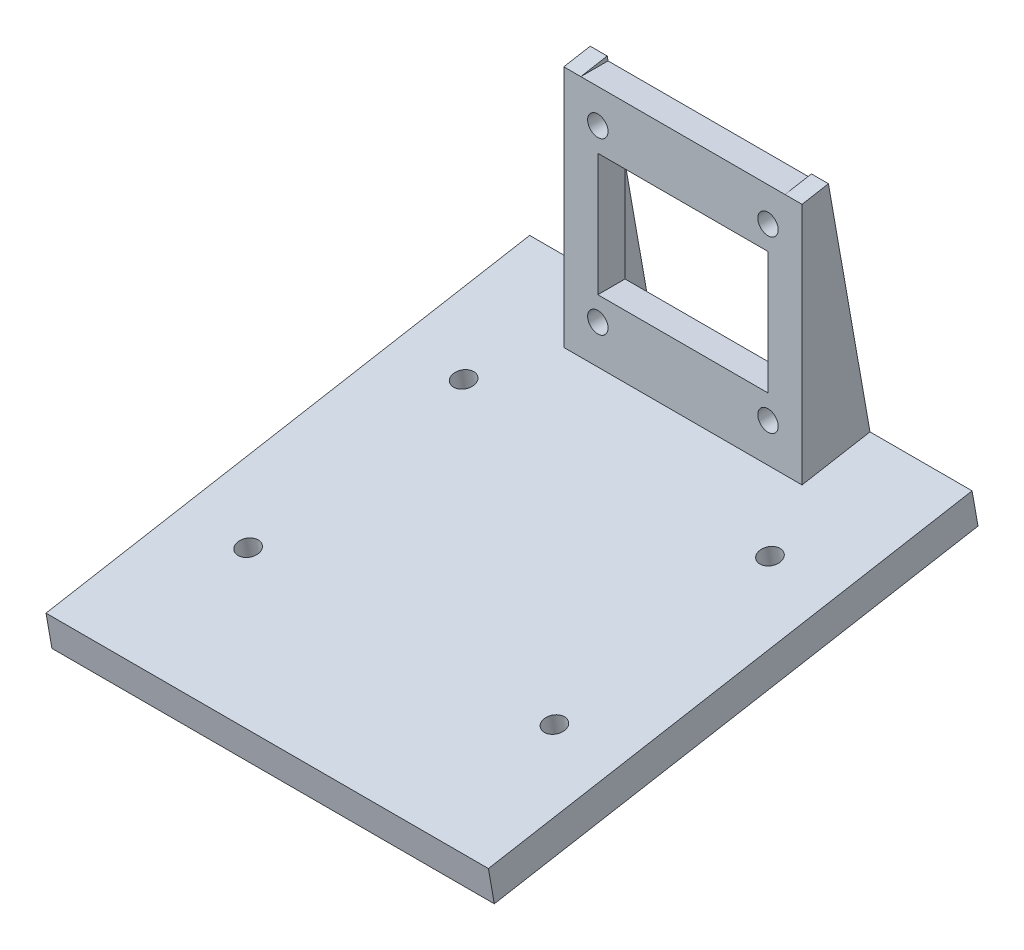
from build123d import *

# Parameters (mm, degrees)
SKETCH_1_W          = 35
SKETCH_1_H          = 35
SKETCH_1_R          = 1.5
SKETCH_1_W_2        = 25
SKETCH_1_H_2        = 18
EXTRUDE_1_DEPTH     = 4
EXTRUDE_START       = -35.162864
SKETCH_3_W          = 2.5
SKETCH_3_H          = 6.077686218
EXTRUDE_2_DEPTH     = 35.162864
CUT_EXTRUDE_1_DEPTH = 35
SKETCH_5_W          = 65
SKETCH_5_H          = 72.155372437
EXTRUDE_3_DEPTH     = 5
EXTRUDE_4_DEPTH     = 35
SKETCH_7_R          = 1.5
CUT_EXTRUDE_2_DEPTH = 5


with BuildPart() as part:
    # 草图1 → 凸台-拉伸1 (new body)
    with BuildSketch(Plane.XY):
        with Locations((17.5, -17.5)):
            Rectangle(SKETCH_1_W, SKETCH_1_H)
        with Locations((5, -5)):
            Circle(SKETCH_1_R, mode=Mode.SUBTRACT)
        with Locations(Location((30, -30, 0), (0, 0, 180))):
            Circle(SKETCH_1_R, mode=Mode.SUBTRACT)
        with Locations((30, -5)):
            Circle(SKETCH_1_R, mode=Mode.SUBTRACT)
        with Locations(Location((5, -30, 0), (0, 0, 180))):
            Circle(SKETCH_1_R, mode=Mode.SUBTRACT)
        with Locations((17.5, -17.5)):
            Rectangle(SKETCH_1_W_2, SKETCH_1_H_2, mode=Mode.SUBTRACT)
    extrude(amount=EXTRUDE_1_DEPTH)

    # 草图3 → 凸台-拉伸2 (add)
    with BuildSketch(Plane(origin=(0, -33.944620864, -5.985352508), x_dir=(-1, 0, 0), z_dir=(0, -0.9848077530122076, -0.17364817766693394)).offset(EXTRUDE_START)):
        with Locations((-33.75, -3.038843109)):
            Rectangle(SKETCH_3_W, SKETCH_3_H)
        with Locations((-1.25, -3.038843109)):
            Rectangle(SKETCH_3_W, SKETCH_3_H)
    extrude(amount=EXTRUDE_2_DEPTH)

    # 草图4 → 切除-拉伸1 (cut)
    with BuildSketch(Plane(origin=(35, 0, 0), x_dir=(0, 0, -1), z_dir=(1, 0, 0))):
        Polygon((-4, 0), (-6.105967267, -0.37133885), (-4, -12.314872722), align=None)
    extrude(amount=-CUT_EXTRUDE_1_DEPTH, mode=Mode.SUBTRACT)



with BuildPart() as body_2:
    # 草图5 → 凸台-拉伸3 (new body)
    with BuildSketch(Plane(origin=(0, -33.944620864, -5.985352508), x_dir=(-1, 0, 0), z_dir=(0, -0.9848077530122076, -0.17364817766693394))):
        with Locations((-17.5, -36.077686219)):
            Rectangle(SKETCH_5_W, SKETCH_5_H)
    extrude(amount=EXTRUDE_3_DEPTH)


with BuildPart() as part_1:
    add(part.part)

    add(body_2.part)  # 凸台-拉伸4 merges body 2
    # 草图6 → 凸台-拉伸4 (add)
    with BuildSketch(Plane.ZY):
        Polygon((4, -35), (4, -35.705307923), (0, -35), align=None)
    extrude(amount=-EXTRUDE_4_DEPTH)

    # 草图7 → 切除-拉伸2 (cut)
    with BuildSketch(Plane(origin=(0, -33.944620864, -5.985352508), x_dir=(1, 0, 0), z_dir=(0, 0.9848077530122076, 0.17364817766693394))):
        with Locations(Location((-5, -20, 0), (0, 0, 270))):
            Circle(SKETCH_7_R)
        with Locations(Location((-5, -52.155372437, 0), (0, 0, 270))):
            Circle(SKETCH_7_R)
        with Locations(Location((40, -52.155372437, 0), (0, 0, 270))):
            Circle(SKETCH_7_R)
        with Locations(Location((40, -20, 0), (0, 0, 270))):
            Circle(SKETCH_7_R)
    extrude(amount=-CUT_EXTRUDE_2_DEPTH, mode=Mode.SUBTRACT)


solid = part_1.part
